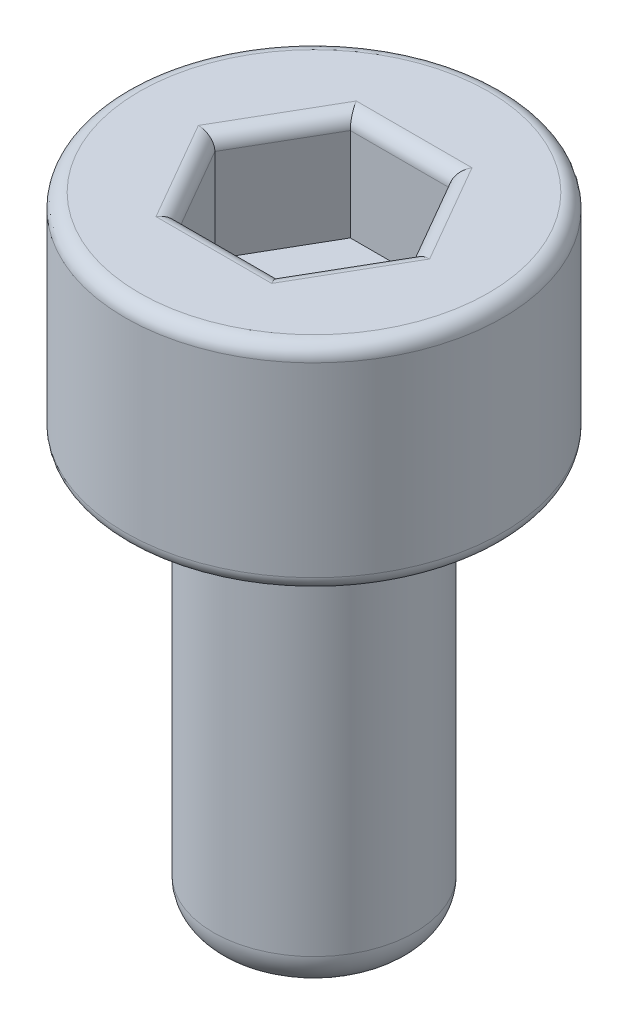
from build123d import *

# Parameters (mm, degrees)
SKETCH1_R           = 2.64
BOSS_EXTRUDE1_DEPTH = 3
SKETCH2_R           = 1.405
BOSS_EXTRUDE2_DEPTH = 5.76
FILLET1_R           = 0.2
CUT_EXTRUDE1_DEPTH  = 1.5
FILLET2_R           = 0.2
FILLET3_R           = 0.5


with BuildPart() as part:
    # Sketch1 → Boss-Extrude1 (new body)
    with BuildSketch(Plane(origin=(0, 0, 0), x_dir=(1, 0, 0), z_dir=(0, 1, 0))):
        with Locations(Location((0, 0, 0), (0, 0, 270))):
            Circle(SKETCH1_R)
    extrude(amount=BOSS_EXTRUDE1_DEPTH)

    # Sketch2 → Boss-Extrude2 (add)
    with BuildSketch(Plane.XZ):
        with Locations(Location((0, 0, 0), (0, 0, 90))):
            Circle(SKETCH2_R)
    extrude(amount=BOSS_EXTRUDE2_DEPTH)

    # Fillet1
    fillet1_edges = [part.edges().sort_by_distance(p)[0] for p in [
        (0, 0, -2.64),
        (0, 3, -2.64),
    ]]
    fillet(fillet1_edges, radius=FILLET1_R)

    # Sketch3 → Cut-Extrude1 (cut)
    with BuildSketch(Plane(origin=(0, 3, 0), x_dir=(1, 0, 0), z_dir=(0, 1, 0))):
        Polygon((1.385640646, 0), (0.692820323, 1.2), (-0.692820323, 1.2), (-1.385640646, 0), (-0.692820323, -1.2), (0.692820323, -1.2), align=None)
    extrude(amount=-CUT_EXTRUDE1_DEPTH, mode=Mode.SUBTRACT)

    # Fillet2
    fillet2_edges = [part.edges().sort_by_distance(p)[0] for p in [
        (1.039230485, 3, 0.6),
        (1.039230485, 3, -0.6),
        (0, 3, -1.2),
        (-1.039230485, 3, -0.6),
        (-1.039230485, 3, 0.6),
        (0, 3, 1.2),
    ]]
    fillet(fillet2_edges, radius=FILLET2_R)

    # Fillet3
    fillet3_edges = [part.edges().sort_by_distance(p)[0] for p in [
        (0, -5.76, -1.405),
    ]]
    fillet(fillet3_edges, radius=FILLET3_R)


solid = part.part
